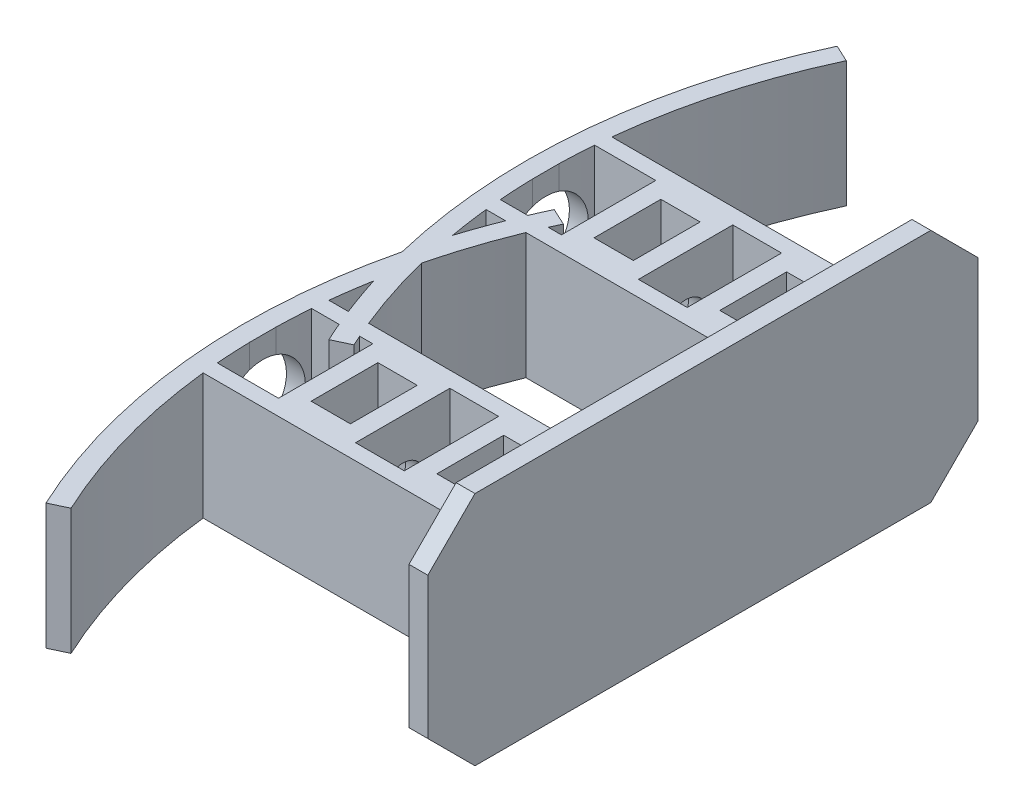
from build123d import *

# Parameters (mm, degrees)
BOSS_EXTRUDE1_DEPTH       = 8
BOSS_EXTRUDE1_DEPTH_BACK  = 8
SKETCH1_W                 = 40
SKETCH1_H                 = 16
SHELL1_T                  = -2
SKETCH3_R                 = 4.470610275
CUT_EXTRUDE1_DEPTH        = 10
SKETCH4_W                 = 12
SKETCH4_H                 = 14
SKETCH4_R                 = 2.75
BOSS_EXTRUDE2_DEPTH       = 2.4
LPATTERN1_COUNT           = 2
LPATTERN1_PITCH           = 7.4
LPATTERN2_COUNT           = 2
LPATTERN2_PITCH           = 16
LPATTERN2_COPY_1_SKETCH_W = 12
LPATTERN2_COPY_1_SKETCH_H = 14
LPATTERN2_COPY_1_SKETCH_R = 2.75
LPATTERN2_COPY_1_DEPTH    = 2.4
BOSS_EXTRUDE4_DEPTH       = 5
LPATTERN3_COUNT           = 2
LPATTERN3_PITCH           = 16
BOSS_EXTRUDE6_START       = -16
BOSS_EXTRUDE6_DEPTH       = 16
SKETCH12_R                = 5.25
CUT_EXTRUDE3_DEPTH        = 45.824637279
LPATTERN4_COUNT           = 2
LPATTERN4_PITCH           = 36
BOSS_EXTRUDE5_DEPTH       = 2.4


with BuildPart() as part:
    # Sketch1 → Boss-Extrude1 (new, two sides: drawn at the far end of the back side and taken through both)
    with BuildSketch(Plane.XY.offset(-BOSS_EXTRUDE1_DEPTH_BACK)):
        with Locations((3, 0)):
            Rectangle(SKETCH1_W, SKETCH1_H)
    extrude(amount=BOSS_EXTRUDE1_DEPTH + BOSS_EXTRUDE1_DEPTH_BACK)

    # Shell1
    shell1_openings = [part.faces().sort_by_distance(p)[0] for p in [
        (3, 8, 0),
    ]]
    offset(amount=SHELL1_T, openings=shell1_openings, kind=Kind.INTERSECTION)

    # Sketch3 → Cut-Extrude1 (cut)
    with BuildSketch(Plane.ZY.offset(17)):
        Circle(SKETCH3_R)
    extrude(amount=-CUT_EXTRUDE1_DEPTH, mode=Mode.SUBTRACT)

    # Sketch4 → Boss-Extrude2 (add)
    with BuildSketch(Plane(origin=(-7, 0, 0), x_dir=(0, 0, -1), z_dir=(1, 0, 0))):
        with Locations((0, 1)):
            Rectangle(SKETCH4_W, SKETCH4_H)
        Circle(SKETCH4_R, mode=Mode.SUBTRACT)
    boss_extrude2 = extrude(amount=BOSS_EXTRUDE2_DEPTH)

    # LPattern1: Boss-Extrude2 ×2
    with Locations(*[(i * LPATTERN1_PITCH, 0, 0) for i in range(1, LPATTERN1_COUNT)]):
        add(boss_extrude2)

    # LPattern2: Boss-Extrude2 ×2
    with Locations(*[(i * LPATTERN2_PITCH, 0, 0) for i in range(1, LPATTERN2_COUNT)]):
        add(boss_extrude2)

    # LPattern2 copy 1 sketch → LPattern2 copy 1 (add)
    with BuildSketch(Plane(origin=(16.4, 0, 0), x_dir=(0, 0, -1), z_dir=(1, 0, 0))):
        with Locations((0, 1)):
            Rectangle(LPATTERN2_COPY_1_SKETCH_W, LPATTERN2_COPY_1_SKETCH_H)
        Circle(LPATTERN2_COPY_1_SKETCH_R, mode=Mode.SUBTRACT)
    extrude(amount=LPATTERN2_COPY_1_DEPTH)

    # Sketch6 → Boss-Extrude4 (add)
    with BuildSketch(Plane.ZY.offset(-16.4)):
        Polygon((-4.25, 2.453738644), (-4.25, 8), (-6, 8), (-6, -6), (6, -6), (6, 8), (4.25, 8), (4.25, 2.453738644), (4.25, -2.453738644), (0, -4.907477288), (-4.25, -2.453738644), align=None)
    boss_extrude4 = extrude(amount=BOSS_EXTRUDE4_DEPTH)

    # LPattern3: Boss-Extrude4 ×2
    with Locations(*[(-i * LPATTERN3_PITCH, 0, 0) for i in range(1, LPATTERN3_COUNT)]):
        add(boss_extrude4)

    # Sketch11 → Boss-Extrude6 (add)
    with BuildSketch(Plane.XZ.offset(8).offset(BOSS_EXTRUDE6_START)):
        with BuildLine():
            ThreePointArc((-10.251996289, 32.330297023), (-14.636700237, 20.445466564), (-17, 8))
            Line((-17, 8), (-14.58633595, 8))
            ThreePointArc((-14.58633595, 8), (-12.290169012, 19.925625473), (-8.0768576, 31.316013195))
            Line((-8.0768576, 31.316013195), (-10.251996289, 32.330297023))
        make_face()
        with BuildLine():
            ThreePointArc((-17, 8), (-17.41945058, 0), (-17, -8))
            Line((-17, -8), (-17, 8))
        make_face()
        with BuildLine():
            Line((-17, 8), (-17, -8))
            Line((-17, -8), (-14.58633595, -8))
            ThreePointArc((-14.58633595, -8), (-15.01945058, 0), (-14.58633595, 8))
            Line((-14.58633595, 8), (-17, 8))
        make_face()
        with BuildLine():
            ThreePointArc((-17, -8), (-14.636700237, -20.445466564), (-10.251996289, -32.330297023))
            Line((-10.251996289, -32.330297023), (-8.0768576, -31.316013195))
            ThreePointArc((-8.0768576, -31.316013195), (-12.290169012, -19.925625473), (-14.58633595, -8))
            Line((-14.58633595, -8), (-17, -8))
        make_face()
    extrude(amount=BOSS_EXTRUDE6_DEPTH)

    # Sketch12 → Cut-Extrude3 (cut, through all)
    with BuildSketch(Plane.ZY.offset(7)):
        with Locations(Location((0, 0, 0), (0, 0, 108.866979722))):
            Circle(SKETCH12_R)
    extrude(amount=CUT_EXTRUDE3_DEPTH, mode=Mode.SUBTRACT)


with BuildPart() as lpattern4_1:
    # LPattern4: pattern copy
    add(part.part.moved(Location(Vector(0, 0, -1) * (1 * LPATTERN4_PITCH))))


with BuildPart() as part_1:
    add(part.part)

    add(lpattern4_1.part)  # Boss-Extrude5 merges LPattern4_1
    # Sketch8 → Boss-Extrude5 (add)
    with BuildSketch(Plane(origin=(23, 0, 0), x_dir=(0, 0, -1), z_dir=(1, 0, 0))):
        Polygon((47, -15), (-11, -15), (-17, -9), (-17, 9), (-11, 15), (47, 15), (53, 9), (53, -9), align=None)
    extrude(amount=-BOSS_EXTRUDE5_DEPTH)


solid = part_1.part
